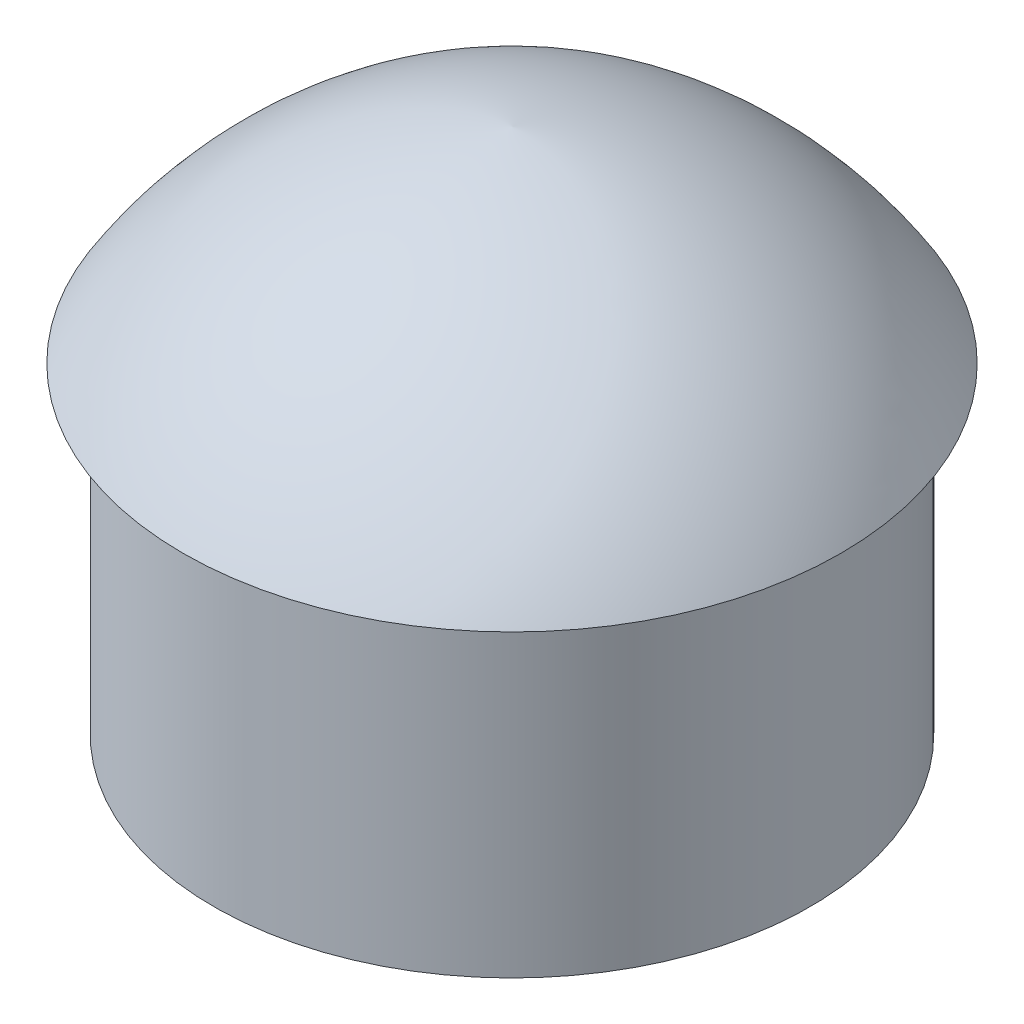
from build123d import *


with BuildPart() as part:
    # Sketch1 → Revolve1 (revolve)
    with BuildSketch(Plane.XY, mode=Mode.PRIVATE) as revolve1_sk:
        with BuildLine():
            Line((0, 12), (0, -12))
            Line((0, -12), (13.6, -12))
            Line((13.6, -12), (13.6, 2.654379363))
            Line((13.6, 2.654379363), (15, 2.654379363))
            ThreePointArc((15, 2.654379363), (8.588284241, 9.073918363), (0, 12))
        make_face()
    revolve(revolve1_sk.sketch.rotate(Axis((0, 12, 0), (0, -1, 0)), 180), axis=Axis((0, 12, 0), (0, -1, 0)))


solid = part.part
